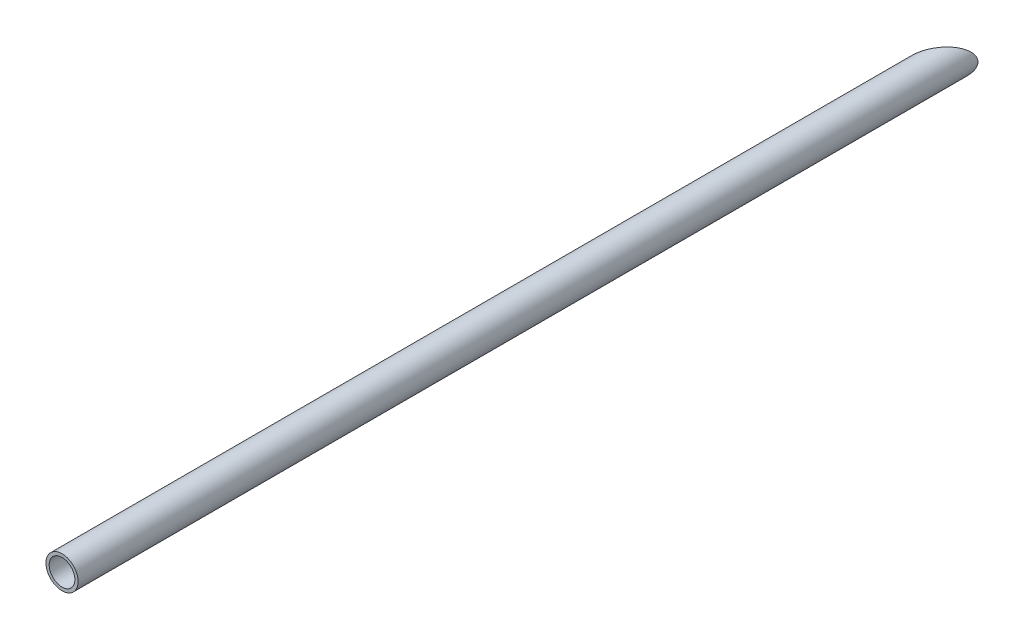
from build123d import *

# Parameters (mm, degrees)
SKETCH1_R               = 15.875
SKETCH1_R_2             = 12.7
BOSS_EXTRUDE1_DEPTH     = 889
CUT_EXTRUDE1_DEPTH      = 890.283436959
CUT_EXTRUDE1_DEPTH_BACK = 890.283436959


with BuildPart() as part:
    # Sketch1 → Boss-Extrude1 (new body)
    with BuildSketch(Plane.XY):
        Circle(SKETCH1_R)
        Circle(SKETCH1_R_2, mode=Mode.SUBTRACT)
    extrude(amount=BOSS_EXTRUDE1_DEPTH)

    # Sketch3 → Cut-Extrude1 (cut, two sides: drawn at the far end of the back side and taken through both)
    with BuildSketch(Plane(origin=(0, 0, 0), x_dir=(1, 0, 0), z_dir=(0, 1, 0)).offset(-CUT_EXTRUDE1_DEPTH_BACK)):
        Polygon((0, 0), (15.875, 0), (-47.625, -90.687398428), (-47.625, 0), align=None)
    extrude(amount=CUT_EXTRUDE1_DEPTH + CUT_EXTRUDE1_DEPTH_BACK, mode=Mode.SUBTRACT)


solid = part.part
